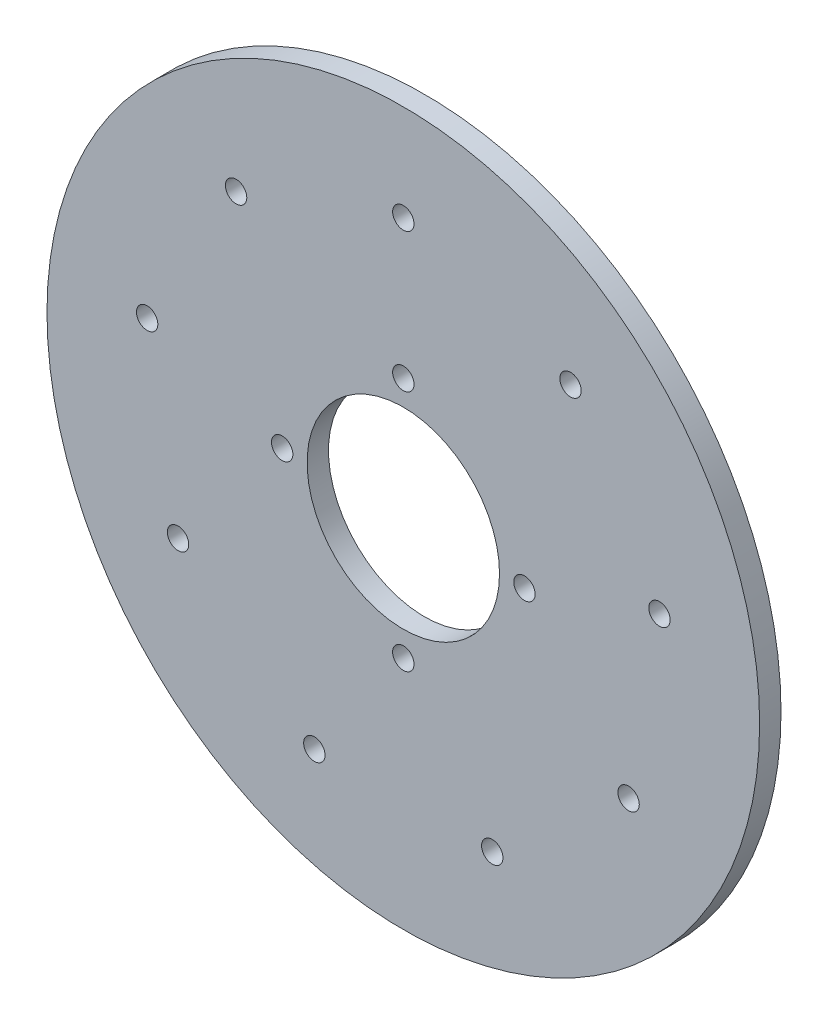
from build123d import *

# Parameters (mm, degrees)
SKETCH_1_R      = 50
SKETCH_1_R_2    = 1.5
SKETCH_1_R_3    = 13.5
EXTRUDE_1_DEPTH = 3


with BuildPart() as part:
    # 草图1 → 凸台-拉伸1 (new body)
    with BuildSketch(Plane.XY):
        Circle(SKETCH_1_R)
        with Locations((0, 17)):
            Circle(SKETCH_1_R_2, mode=Mode.SUBTRACT)
        with Locations((17, 0)):
            Circle(SKETCH_1_R_2, mode=Mode.SUBTRACT)
        with Locations((0, -17)):
            Circle(SKETCH_1_R_2, mode=Mode.SUBTRACT)
        with Locations((-17, 0)):
            Circle(SKETCH_1_R_2, mode=Mode.SUBTRACT)
        with Locations((-23.461747754, 27.960622174)):
            Circle(SKETCH_1_R_2, mode=Mode.SUBTRACT)
        with Locations((0, 36.5)):
            Circle(SKETCH_1_R_2, mode=Mode.SUBTRACT)
        with Locations((23.461747754, 27.960622174)):
            Circle(SKETCH_1_R_2, mode=Mode.SUBTRACT)
        with Locations((35.945482985, 6.338158485)):
            Circle(SKETCH_1_R_2, mode=Mode.SUBTRACT)
        with Locations((31.609927238, -18.25)):
            Circle(SKETCH_1_R_2, mode=Mode.SUBTRACT)
        with Locations((12.483735231, -34.298780659)):
            Circle(SKETCH_1_R_2, mode=Mode.SUBTRACT)
        with Locations((-12.483735231, -34.298780659)):
            Circle(SKETCH_1_R_2, mode=Mode.SUBTRACT)
        with Locations((-31.609927238, -18.25)):
            Circle(SKETCH_1_R_2, mode=Mode.SUBTRACT)
        with Locations((-35.945482985, 6.338158485)):
            Circle(SKETCH_1_R_2, mode=Mode.SUBTRACT)
        Circle(SKETCH_1_R_3, mode=Mode.SUBTRACT)
    extrude(amount=EXTRUDE_1_DEPTH)


solid = part.part
